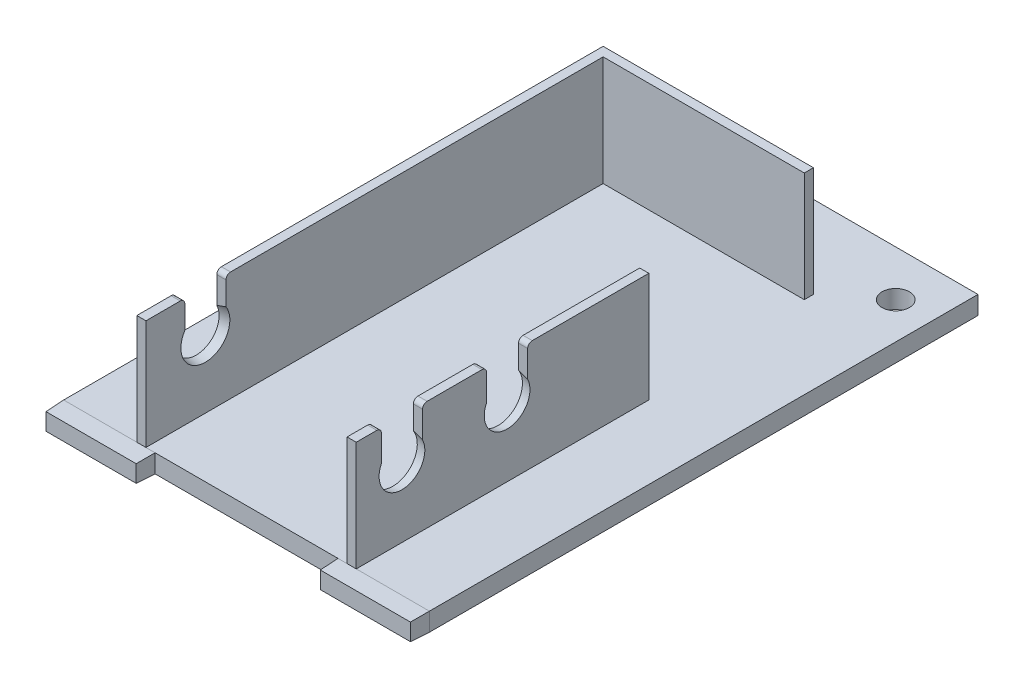
from build123d import *

# Parameters (mm, degrees)
SKETCH1_W                     = 60
SKETCH1_H                     = 2
EXTRUDE_THIN1_DEPTH           = 20
SKETCH2_W                     = 1
SKETCH2_H                     = 32
EXTRUDE_THIN2_DEPTH           = 12
SKETCH3_R                     = 1.5
CUT_EXTRUDE1_DEPTH            = 65.373907758
SKETCH4_W                     = 10
SKETCH4_H                     = 2
BOSS_EXTRUDE1_DEPTH           = 2
BOSS_EXTRUDE1_DRAFT           = 2
BOSS_EXTRUDE1_PROFILE_2_DEPTH = 2
BOSS_EXTRUDE1_PROFILE_2_DRAFT = 2
SKETCH6_R                     = 2.5
CUT_EXTRUDE4_DEPTH            = 1
CUT_EXTRUDE4_DRAFT            = 10
CUT_EXTRUDE4_PROFILE_2_DEPTH  = 1
CUT_EXTRUDE4_PROFILE_2_DRAFT  = 10
SKETCH7_R                     = 2.5
CUT_EXTRUDE6_DEPTH            = 1
CUT_EXTRUDE6_DRAFT            = 10
CUT_EXTRUDE7_REACH            = 73.162
SKETCH8_W                     = 4.5
SKETCH8_H                     = 6.050990024
CUT_EXTRUDE8_REACH            = 73.162
SKETCH9_W                     = 4.5
SKETCH9_H                     = 5.78600983
FILLET1_R                     = 0.5


with BuildPart() as part:
    # Sketch1 → Extrude-Thin1 (new, symmetric)
    with BuildSketch(Plane(origin=(0, 0, 0), x_dir=(0, 0, -1), z_dir=(1, 0, 0))):
        with Locations((-30, 1)):
            Rectangle(SKETCH1_W, SKETCH1_H)
    extrude(amount=EXTRUDE_THIN1_DEPTH, both=True)

    # Sketch2 → Extrude-Thin2 (add)
    with BuildSketch(Plane(origin=(0, 2, 0), x_dir=(1, 0, 0), z_dir=(0, 1, 0))):
        with Locations((11.5, -44)):
            Rectangle(SKETCH2_W, SKETCH2_H)
        Polygon((11, -10), (-11, -10), (-11, -60), (-12, -60), (-12, -9), (11, -9), align=None)
    extrude(amount=EXTRUDE_THIN2_DEPTH)

    # Sketch3 → Cut-Extrude1 (cut, through all)
    with BuildSketch(Plane(origin=(0, 2, 0), x_dir=(1, 0, 0), z_dir=(0, 1, 0))):
        with Locations(Location((-16, -5, 0), (0, 0, 270))):
            Circle(SKETCH3_R)
        with Locations(Location((16, -5, 0), (0, 0, 270))):
            Circle(SKETCH3_R)
    extrude(amount=-CUT_EXTRUDE1_DEPTH, mode=Mode.SUBTRACT)


with BuildPart() as boss_extrude1_tool:
    # Sketch4 → Boss-Extrude1 (with draft: the straight prism first)
    with BuildSketch(Plane.XY.offset(60)):
        with Locations((-15, 1)):
            Rectangle(SKETCH4_W, SKETCH4_H)
    extrude(amount=BOSS_EXTRUDE1_DEPTH)
    # Boss-Extrude1: the draft: its side faces are tilted about the plane it starts from
    boss_extrude1_sides = [boss_extrude1_tool.faces().sort_by_distance(p)[0] for p in [
        (-20, 1, 61),
        (-15, 0, 61),
        (-10, 1, 61),
        (-15, 2, 61),
    ]]
    draft(boss_extrude1_sides, Plane.XY.offset(60), BOSS_EXTRUDE1_DRAFT)


with BuildPart() as part_1:
    add(part.part)

    # Boss-Extrude1: add boss_extrude1_tool
    add(boss_extrude1_tool.part)


with BuildPart() as boss_extrude1_profile_2_tool:
    # Sketch4 → Boss-Extrude1 profile 2 (with draft: the straight prism first)
    with BuildSketch(Plane.XY.offset(60)):
        with Locations((15, 1)):
            Rectangle(SKETCH4_W, SKETCH4_H)
    extrude(amount=BOSS_EXTRUDE1_PROFILE_2_DEPTH)
    # Boss-Extrude1 profile 2: the draft: its side faces are tilted about the plane it starts from
    boss_extrude1_profile_2_sides = [boss_extrude1_profile_2_tool.faces().sort_by_distance(p)[0] for p in [
        (10, 1, 61),
        (15, 0, 61),
        (20, 1, 61),
        (15, 2, 61),
    ]]
    draft(boss_extrude1_profile_2_sides, Plane.XY.offset(60), BOSS_EXTRUDE1_PROFILE_2_DRAFT)


with BuildPart() as part_2:
    add(part_1.part)

    # Boss-Extrude1 profile 2: add boss_extrude1_profile_2_tool
    add(boss_extrude1_profile_2_tool.part)


with BuildPart() as cut_extrude4_tool:
    # Sketch6 → Cut-Extrude4 (with draft: the straight prism first)
    with BuildSketch(Plane(origin=(12, 0, 0), x_dir=(0, 0, -1), z_dir=(1, 0, 0))):
        with Locations((-55, 9.5)):
            Circle(SKETCH6_R)
    extrude(amount=-CUT_EXTRUDE4_DEPTH)
    # Cut-Extrude4: the draft: its side faces are tilted about the plane it starts from
    cut_extrude4_sides = [cut_extrude4_tool.faces().sort_by_distance(p)[0] for p in [
        (11.5, 9.5, 57.5),
    ]]
    draft(cut_extrude4_sides, Plane(origin=(12, 0, 0), x_dir=(0, 0, -1), z_dir=(1, 0, 0)), CUT_EXTRUDE4_DRAFT)


with BuildPart() as part_3:
    add(part_2.part)

    # Cut-Extrude4: cut by cut_extrude4_tool
    add(cut_extrude4_tool.part, mode=Mode.SUBTRACT)


with BuildPart() as cut_extrude4_profile_2_tool:
    # Sketch6 → Cut-Extrude4 profile 2 (with draft: the straight prism first)
    with BuildSketch(Plane(origin=(12, 0, 0), x_dir=(0, 0, -1), z_dir=(1, 0, 0))):
        with Locations((-43.5, 9.5)):
            Circle(SKETCH6_R)
    extrude(amount=-CUT_EXTRUDE4_PROFILE_2_DEPTH)
    # Cut-Extrude4 profile 2: the draft: its side faces are tilted about the plane it starts from
    cut_extrude4_profile_2_sides = [cut_extrude4_profile_2_tool.faces().sort_by_distance(p)[0] for p in [
        (11.5, 9.5, 46),
    ]]
    draft(cut_extrude4_profile_2_sides, Plane(origin=(12, 0, 0), x_dir=(0, 0, -1), z_dir=(1, 0, 0)), CUT_EXTRUDE4_PROFILE_2_DRAFT)


with BuildPart() as part_4:
    add(part_3.part)

    # Cut-Extrude4 profile 2: cut by cut_extrude4_profile_2_tool
    add(cut_extrude4_profile_2_tool.part, mode=Mode.SUBTRACT)


with BuildPart() as cut_extrude6_tool:
    # Sketch7 → Cut-Extrude6 (with draft: the straight prism first)
    with BuildSketch(Plane.ZY.offset(12)):
        with Locations((53.5, 9.5)):
            Circle(SKETCH7_R)
    extrude(amount=-CUT_EXTRUDE6_DEPTH)
    # Cut-Extrude6: the draft: its side faces are tilted about the plane it starts from
    cut_extrude6_sides = [cut_extrude6_tool.faces().sort_by_distance(p)[0] for p in [
        (-11.5, 9.5, 51),
    ]]
    draft(cut_extrude6_sides, Plane.ZY.offset(12), CUT_EXTRUDE6_DRAFT)


with BuildPart() as part_5:
    add(part_4.part)

    # Cut-Extrude6: cut by cut_extrude6_tool
    add(cut_extrude6_tool.part, mode=Mode.SUBTRACT)

    # Sketch8 → Cut-Extrude7 (cut, up to next)
    with BuildSketch(Plane(origin=(12, 0, 0), x_dir=(0, 0, -1), z_dir=(1, 0, 0)), mode=Mode.PRIVATE) as cut_extrude7_sk1:
        with Locations((-55, 12.491774439)):
            Rectangle(SKETCH8_W, SKETCH8_H)
    cut_extrude7_tool1 = extrude(cut_extrude7_sk1.sketch, amount=-CUT_EXTRUDE7_REACH, mode=Mode.PRIVATE) & part_5.part
    # Sketch8 → Cut-Extrude7 (cut, up to next)
    with BuildSketch(Plane(origin=(12, 0, 0), x_dir=(0, 0, -1), z_dir=(1, 0, 0)), mode=Mode.PRIVATE) as cut_extrude7_sk2:
        with Locations((-43.5, 12.460513527)):
            Rectangle(SKETCH8_W, SKETCH8_H)
    cut_extrude7_tool2 = extrude(cut_extrude7_sk2.sketch, amount=-CUT_EXTRUDE7_REACH, mode=Mode.PRIVATE) & part_5.part
    add(cut_extrude7_tool1.solids().sort_by_distance((12, 12.491774, 55))[0], mode=Mode.SUBTRACT)
    add(cut_extrude7_tool2.solids().sort_by_distance((12, 12.460514, 43.5))[0], mode=Mode.SUBTRACT)

    # Sketch9 → Cut-Extrude8 (cut, up to next)
    with BuildSketch(Plane.ZY.offset(12), mode=Mode.PRIVATE) as cut_extrude8_sk1:
        with Locations((53.5, 13.082945191)):
            Rectangle(SKETCH9_W, SKETCH9_H)
    cut_extrude8_tool1 = extrude(cut_extrude8_sk1.sketch, amount=-CUT_EXTRUDE8_REACH, mode=Mode.PRIVATE) & part_5.part
    add(cut_extrude8_tool1.solids().sort_by_distance((-12, 13.082945, 53.5))[0], mode=Mode.SUBTRACT)

    # Fillet1
    fillet1_edges = [part_5.edges().sort_by_distance(p)[0] for p in [
        (11.5, 14, 52.75),
        (11.5, 14, 57.25),
        (11.5, 14, 41.25),
        (11.5, 14, 45.75),
        (-11.5, 14, 55.75),
        (-11.5, 14, 51.25),
    ]]
    fillet(fillet1_edges, radius=FILLET1_R)


solid = part_5.part
